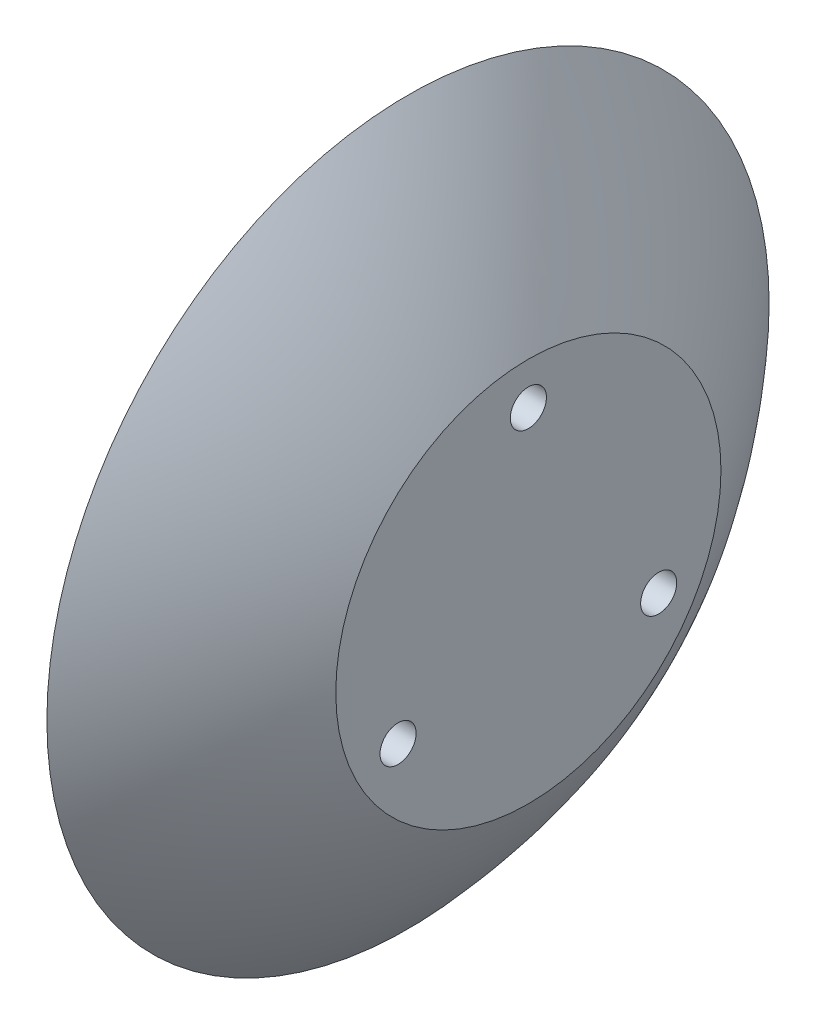
from build123d import *

# Parameters (mm, degrees)
CROQUIS3_R            = 1.5
CORTAR_EXTRUIR1_DEPTH = 10


with BuildPart() as part:
    # Croquis1 → Revolución1 (revolve)
    with BuildSketch(Plane.XY, mode=Mode.PRIVATE) as revoluci_n1_sk:
        with BuildLine():
            Line((0, 0), (0, 30))
            ThreePointArc((0, 30), (5.396386912, 23.283133509), (10, 16))
            Line((10, 16), (10, 0))
            Line((10, 0), (0, 0))
        make_face()
    revolve(revoluci_n1_sk.sketch.rotate(Axis((22.474950153, 0, 0), (-1, 0, 0)), 90), axis=Axis((22.474950153, 0, 0), (-1, 0, 0)))

    # Croquis3 → Cortar-Extruir1 (cut)
    with BuildSketch(Plane(origin=(10, 0, 0), x_dir=(0, 0, -1), z_dir=(1, 0, 0))):
        with Locations((0, 12.5)):
            Circle(CROQUIS3_R)
        with Locations((10.825317547, -6.25)):
            Circle(CROQUIS3_R)
        with Locations((-10.825317547, -6.25)):
            Circle(CROQUIS3_R)
    extrude(amount=-CORTAR_EXTRUIR1_DEPTH, mode=Mode.SUBTRACT)


solid = part.part
